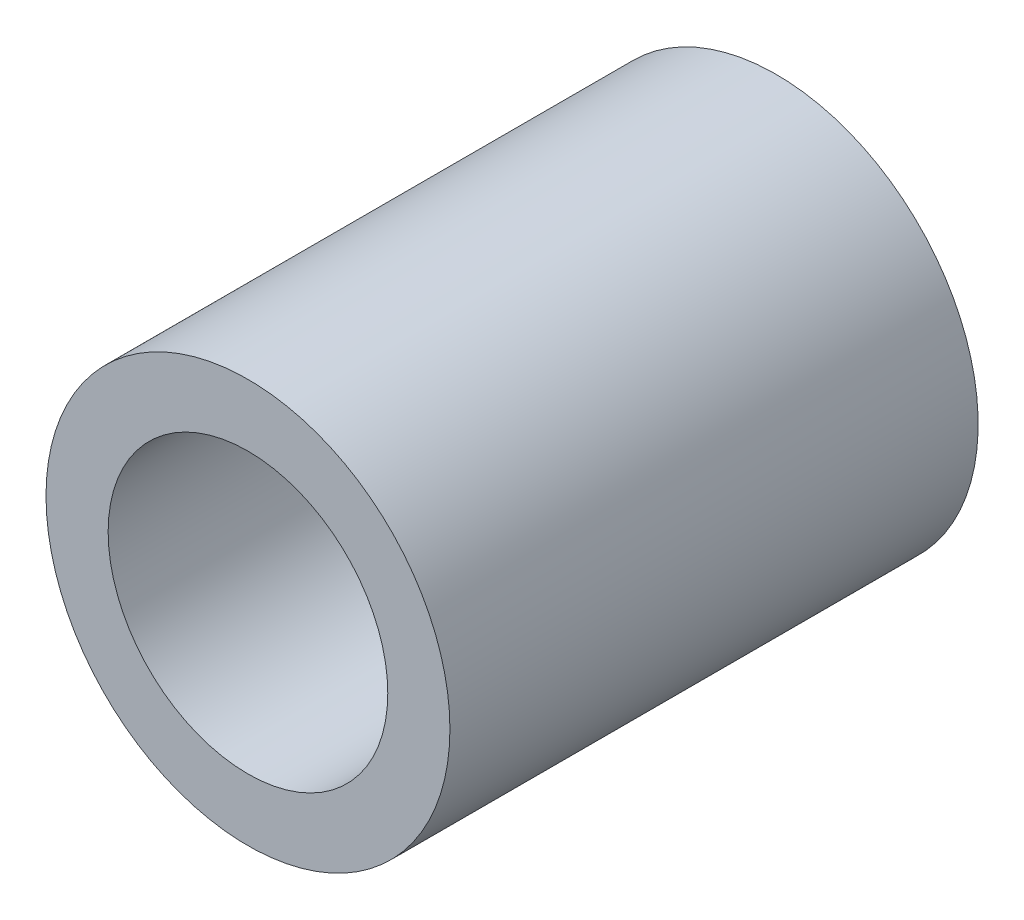
from build123d import *

# Parameters (mm, degrees)
SKETCH1_R                = 6.5
SKETCH1_R_2              = 4.5
BOSS_EXTRUDE1_DEPTH      = 15
BOSS_EXTRUDE2_DEPTH      = 2
BOSS_EXTRUDE2_DEPTH_BACK = 3
SKETCH2_R                = 6.5
SKETCH2_R_2              = 3.223163269


with BuildPart() as part:
    # Sketch1 → Boss-Extrude1 (new body)
    with BuildSketch(Plane.XY):
        Circle(SKETCH1_R)
        Circle(SKETCH1_R_2, mode=Mode.SUBTRACT)
    extrude(amount=BOSS_EXTRUDE1_DEPTH)

    # Sketch2 → Boss-Extrude2 (add, two sides: drawn at the far end of the back side and taken through both)
    with BuildSketch(Plane(origin=(0, 0, 0), x_dir=(-1, 0, 0), z_dir=(0, 0, -1)).offset(-BOSS_EXTRUDE2_DEPTH_BACK)):
        Circle(SKETCH2_R)
        Circle(SKETCH2_R_2, mode=Mode.SUBTRACT)
    extrude(amount=BOSS_EXTRUDE2_DEPTH + BOSS_EXTRUDE2_DEPTH_BACK)


solid = part.part
